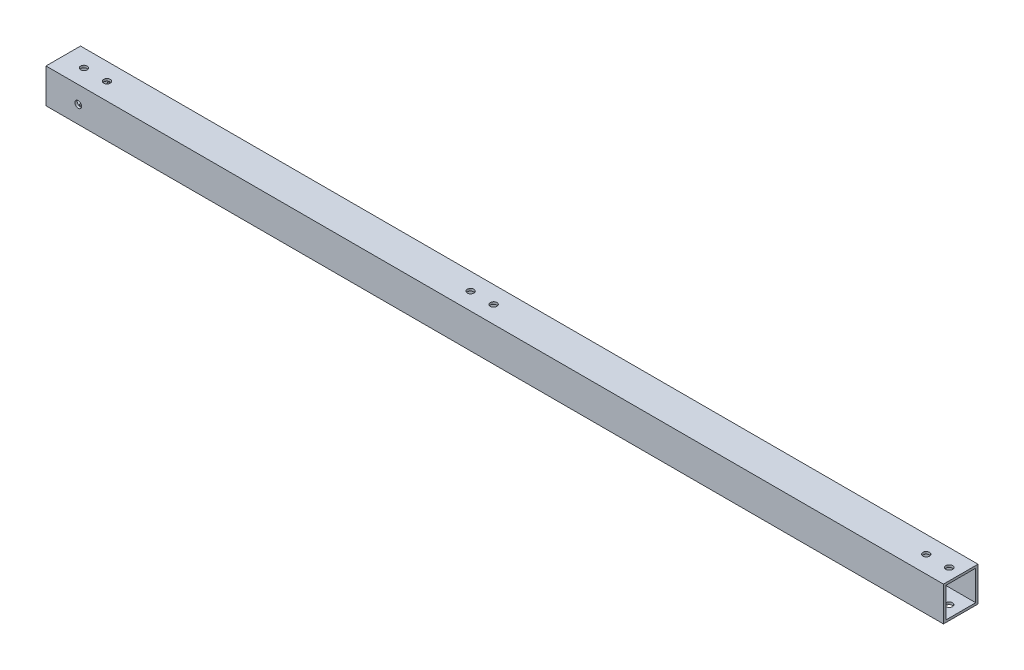
from build123d import *

# Parameters (mm, degrees)
SKETCH_1_W          = 15
SKETCH_1_H          = 15
SKETCH_1_W_2        = 13
SKETCH_1_H_2        = 13
EXTRUDE_1_DEPTH     = 390
SKETCH_2_R          = 1.45
CUT_EXTRUDE_1_DEPTH = 391.36041039
SKETCH_3_R          = 1.45
CUT_EXTRUDE_2_DEPTH = 391.36041039


with BuildPart() as part:
    # 草图1 → 凸台-拉伸1 (new body)
    with BuildSketch(Plane(origin=(0, 0, 0), x_dir=(0, 0, -1), z_dir=(1, 0, 0))):
        Rectangle(SKETCH_1_W, SKETCH_1_H)
        Rectangle(SKETCH_1_W_2, SKETCH_1_H_2, mode=Mode.SUBTRACT)
    extrude(amount=EXTRUDE_1_DEPTH)

    # 草图2 → 切除-拉伸1 (cut, through all)
    with BuildSketch(Plane.XZ.offset(7.5)):
        with Locations(Location((375, 0, 0), (0, 0, 270))):
            Circle(SKETCH_2_R)
        with Locations(Location((385, 0, 0), (0, 0, 270))):
            Circle(SKETCH_2_R)
        with Locations(Location((9, 0, 0), (0, 0, 270))):
            Circle(SKETCH_2_R)
        with Locations(Location((19, 0, 0), (0, 0, 270))):
            Circle(SKETCH_2_R)
        with Locations(Location((177, 0, 0), (0, 0, 270))):
            Circle(SKETCH_2_R)
        with Locations(Location((187, 0, 0), (0, 0, 270))):
            Circle(SKETCH_2_R)
    extrude(amount=-CUT_EXTRUDE_1_DEPTH, mode=Mode.SUBTRACT)

    # 草图3 → 切除-拉伸2 (cut, through all)
    with BuildSketch(Plane(origin=(0, 0, -7.5), x_dir=(-1, 0, 0), z_dir=(0, 0, -1))):
        with Locations((-14, 0)):
            Circle(SKETCH_3_R)
    extrude(amount=-CUT_EXTRUDE_2_DEPTH, mode=Mode.SUBTRACT)


solid = part.part
